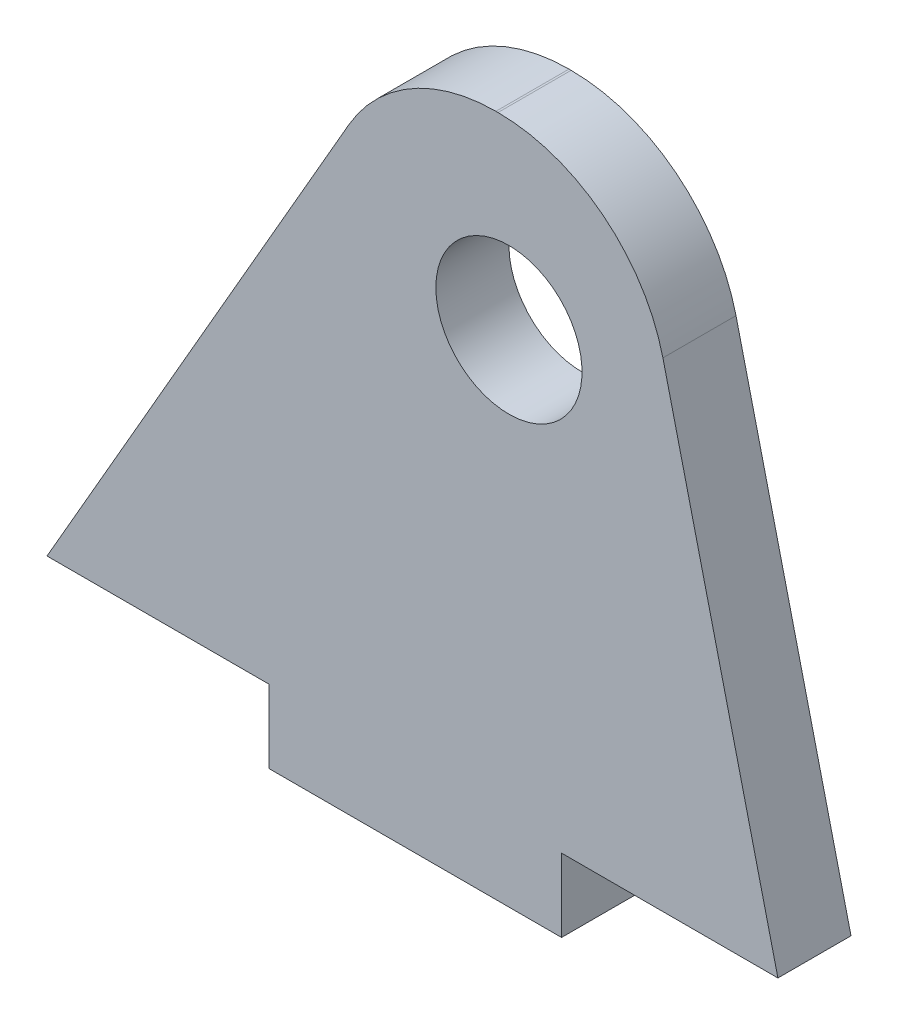
from build123d import *

# Parameters (mm, degrees)
SKETCH1_W                   = 62.178178995
SKETCH1_H                   = 55.159619557
BOSS_EXTRUDE1_DEPTH         = 3.175
F_1_4_0_25_DIAMETER_HOLE1_D = 6.35
CUT_EXTRUDE6_DEPTH          = 84.179265432
FILLET1_R                   = 7.366
SKETCH7_W                   = 12.7
SKETCH7_H                   = 3.175
BOSS_EXTRUDE2_DEPTH         = 3.175


with BuildPart() as part:
    # Sketch1 → Boss-Extrude1 (new body)
    with BuildSketch(Plane.XY):
        with Locations((-31.089089498, 27.579809779)):
            Rectangle(SKETCH1_W, SKETCH1_H)
    extrude(amount=BOSS_EXTRUDE1_DEPTH)

    # 1/4 (0.25) Diameter Hole1 (through all)
    with Locations(Plane(origin=(0, 0, 0), x_dir=(-1, 0, 0), z_dir=(0, 0, -1))):
        with Locations((42.112178995, 18.542)):
            Hole(F_1_4_0_25_DIAMETER_HOLE1_D / 2)

    # Sketch4 → Cut-Extrude6 (cut, through all)
    with BuildSketch(Plane(origin=(0, 0, 0), x_dir=(-1, 0, 0), z_dir=(0, 0, -1))):
        Polygon((46.938178995, 26.4795), (62.178178995, 0), (62.178178995, 55.159619557), (0, 55.159619557), (0, 0), (30.428178995, 0), (36.778178995, 26.4795), align=None)
    extrude(amount=-CUT_EXTRUDE6_DEPTH, mode=Mode.SUBTRACT)

    # Fillet1
    fillet1_edges = [part.edges().sort_by_distance(p)[0] for p in [
        (-36.778178995, 26.4795, 1.5875),
        (-46.938178995, 26.4795, 1.5875),
    ]]
    fillet(fillet1_edges, radius=FILLET1_R)

    # Sketch7 → Boss-Extrude2 (add)
    with BuildSketch(Plane(origin=(0, 0, 0), x_dir=(-1, 0, 0), z_dir=(0, 0, -1))):
        with Locations((46.176178995, -1.5875)):
            Rectangle(SKETCH7_W, SKETCH7_H)
    extrude(amount=-BOSS_EXTRUDE2_DEPTH)


solid = part.part
